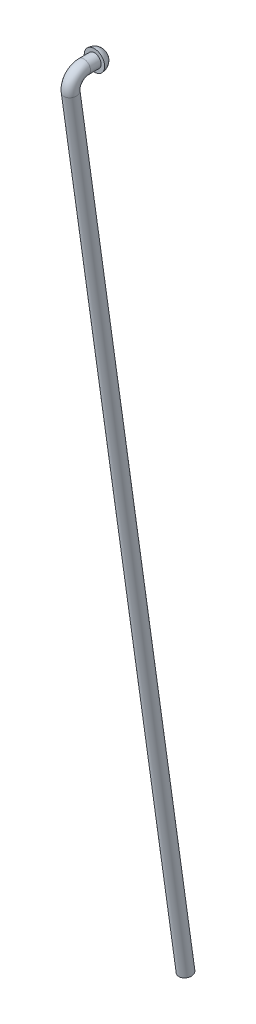
from build123d import *

# Parameters (mm, degrees)
SKETCH2_R = 1.5


with BuildPart() as part:
    # Sweep1: sweep along a path in Sketch1
    with BuildLine(Plane(origin=(0, 0, 0), x_dir=(0, 0, -1), z_dir=(1, 0, 0))) as sweep1_path:
        Line((5.84, 42.385016649), (3.449888964, 42.385016649))
        ThreePointArc((3.449888964, 42.385016649), (1.186103769, 41.353588871), (0.478939197, 38.968534378))
        Line((0.478939197, 38.968534378), (26.349445023, -145.57707194))
    # Sketch2 → Sweep1 (sweep)
    with BuildSketch(Plane.XY.offset(-5.84)):
        with Locations((0, 42.385016649)):
            Circle(SKETCH2_R)
    sweep(path=sweep1_path.line)

    # Sketch3 → Revolve1 (revolve)
    with BuildSketch(Plane(origin=(0, 0, 0), x_dir=(0, 0, -1), z_dir=(1, 0, 0))):
        with BuildLine():
            Line((5.84, 42.385016649), (5.84, 44.685016649))
            ThreePointArc((5.84, 44.685016649), (7.466345597, 44.011362246), (8.14, 42.385016649))
            Line((8.14, 42.385016649), (5.84, 42.385016649))
        make_face()
    revolve(axis=Axis((0, 42.385016649, -8.14), (0, 0, 1)))


solid = part.part
